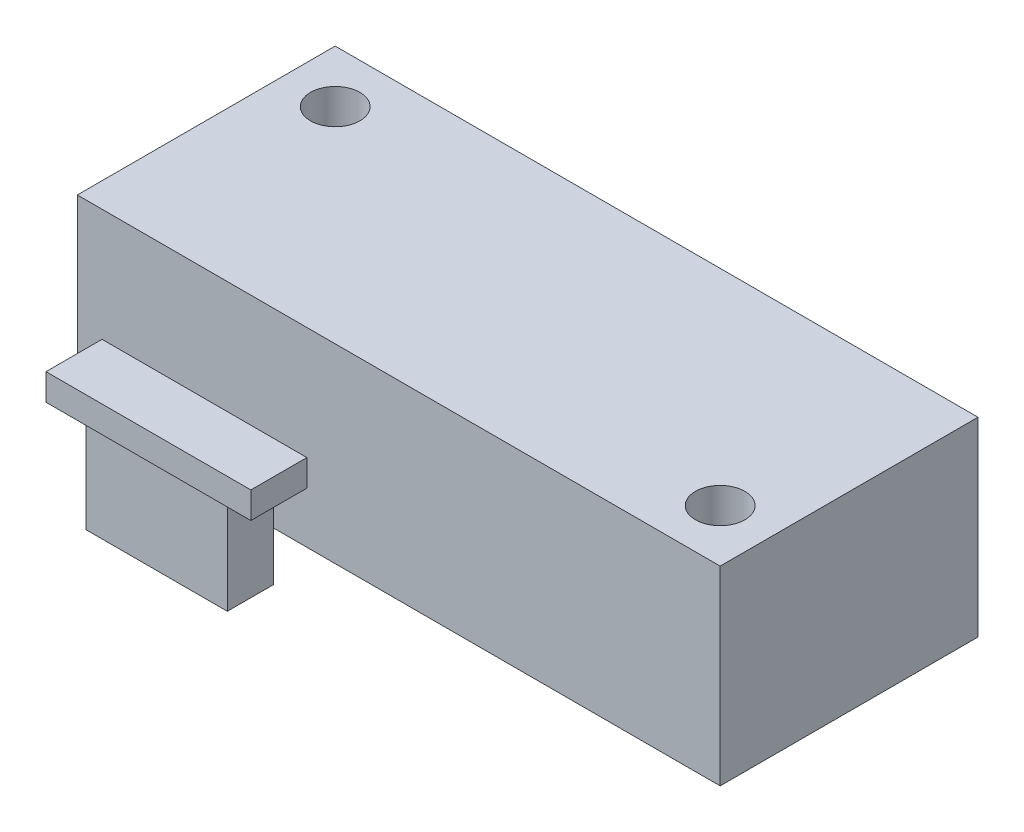
from build123d import *

# Parameters (mm, degrees)
SKETCH1_W           = 27.1018
SKETCH1_H           = 10.8712
SKETCH1_R           = 1.0414
BOSS_EXTRUDE4_DEPTH = 8.0264
SKETCH5_W           = 8.636
SKETCH5_H           = 2.3622
BOSS_EXTRUDE6_DEPTH = 1.1176
SKETCH6_W           = 5.969
SKETCH6_H           = 1.9558
BOSS_EXTRUDE7_DEPTH = 4.1656
SKETCH7_W           = 0.227948718
SKETCH7_H           = 2.54
CUT_EXTRUDE1_DEPTH  = 2.286


with BuildPart() as part:
    # Sketch1 → Boss-Extrude4 (new body)
    with BuildSketch(Plane(origin=(0, 0, 0), x_dir=(1, 0, 0), z_dir=(0, 1, 0))):
        with Locations((13.5509, 5.4356)):
            Rectangle(SKETCH1_W, SKETCH1_H)
        with Locations(Location((2.2098, 8.6614, 0), (0, 0, 270))):
            Circle(SKETCH1_R, mode=Mode.SUBTRACT)
        with Locations(Location((24.892, 2.2098, 0), (0, 0, 270))):
            Circle(SKETCH1_R, mode=Mode.SUBTRACT)
    extrude(amount=BOSS_EXTRUDE4_DEPTH)

    # Sketch5 → Boss-Extrude6 (add)
    with BuildSketch(Plane.XZ.offset(-2.159)):
        with Locations((5.3594, 1.1811)):
            Rectangle(SKETCH5_W, SKETCH5_H)
    extrude(amount=-BOSS_EXTRUDE6_DEPTH)

    # Sketch6 → Boss-Extrude7 (add)
    with BuildSketch(Plane.XZ.offset(-2.159)):
        with Locations((5.3467, 1.0287)):
            Rectangle(SKETCH6_W, SKETCH6_H)
    extrude(amount=BOSS_EXTRUDE7_DEPTH)

    # Sketch7 → Cut-Extrude1 (cut)
    # profile 1 of 12: a face of its own
    with BuildSketch(Plane.XZ):
        Polygon((5.244862276, -1.594756442), (5.244862276, -1.334243621), (6.579990481, -1.334243621), (6.579990481, -1.594756442), (6.026400737, -1.594756442), (6.026400737, -3.874243621), (5.798452019, -3.874243621), (5.798452019, -1.594756442), align=None)
    # profile 2 of 12: a face of its own
    with BuildSketch(Plane.XZ):
        Polygon((6.970759711, -1.334243621), (7.198708429, -1.334243621), (7.198708429, -2.376294903), (8.501272532, -2.376294903), (8.501272532, -1.334243621), (8.72922125, -1.334243621), (8.72922125, -3.874243621), (8.501272532, -3.874243621), (8.501272532, -2.636807724), (7.198708429, -2.636807724), (7.198708429, -3.874243621), (6.970759711, -3.874243621), align=None)
    # profile 3 of 12: a face of its own
    with BuildSketch(Plane.XZ):
        with Locations((9.49447766, -2.604243621)):
            Rectangle(SKETCH7_W, SKETCH7_H)
    # profile 4 of 12: a face of its own
    with BuildSketch(Plane.XZ):
        with BuildLine():
            Line((9.99922125, -3.38425564), (10.213940801, -3.255525672))
            add(Edge.make_bspline(
                [(10.213940801, -3.255525672), (10.233911179, -3.288955255), (10.272173652, -3.353005044), (10.33600121, -3.439552308), (10.402137666, -3.513112273), (10.471072782, -3.573257011), (10.542385784, -3.62060906), (10.616542212, -3.65413868), (10.693292166, -3.675050845), (10.745524597, -3.677590908), (10.771601058, -3.678859006)],
                knots=[0, 0, 0, 0, 1.272034388, 2.437168799, 3.508375237, 4.49857839, 5.41946034, 6.295179144, 7.148887113, 8, 8, 8, 8], degree=3))
            add(Edge.make_bspline(
                [(10.771601058, -3.678859006), (10.793870951, -3.678238758), (10.838021066, -3.677009114), (10.903017665, -3.665193904), (10.966141602, -3.647042245), (11.02609187, -3.621046483), (11.082041259, -3.589595125), (11.131104404, -3.551606756), (11.173519583, -3.509075395), (11.20821534, -3.461626269), (11.234834566, -3.410596109), (11.255293953, -3.35821699), (11.266647806, -3.303666087), (11.268358136, -3.266937351), (11.26922125, -3.248402275)],
                knots=[0, 0, 0, 0, 1.095163259, 2.171163733, 3.241058638, 4.321873601, 5.38011039, 6.391990106, 7.366004449, 8.327778327, 9.272591725, 10.192022065, 11.087607919, 12, 12, 12, 12], degree=3))
            add(Edge.make_bspline(
                [(11.26922125, -3.248402275), (11.268151322, -3.227254344), (11.265976314, -3.184263691), (11.247592897, -3.120836514), (11.218673729, -3.05806762), (11.191994553, -3.019240988), (11.178143526, -2.999083365)],
                knots=[0, 0, 0, 0, 0.938893495, 1.908633276, 2.914225137, 4, 4, 4, 4], degree=3))
            add(Edge.make_bspline(
                [(11.178143526, -2.999083365), (11.166771137, -2.984535098), (11.14289623, -2.953992833), (11.101851635, -2.908530291), (11.053688798, -2.861635781), (11.000055932, -2.811518637), (10.938999348, -2.760509779), (10.87243138, -2.7061768), (10.798652465, -2.650585941), (10.746909402, -2.613304136), (10.720210833, -2.594067339)],
                knots=[0, 0, 0, 0, 0.722233717, 1.516239348, 2.393582979, 3.351407094, 4.387010283, 5.505090956, 6.712668013, 8, 8, 8, 8], degree=3))
            add(Edge.make_bspline(
                [(10.720210833, -2.594067339), (10.693487133, -2.575032878), (10.642393454, -2.538640439), (10.570940654, -2.484629673), (10.507045529, -2.435249265), (10.450992072, -2.390034353), (10.402804936, -2.348978806), (10.362104403, -2.312476873), (10.329927279, -2.279541374), (10.312034372, -2.258175372), (10.304000897, -2.248582563)],
                knots=[0, 0, 0, 0, 1.452282411, 2.77665338, 3.964542531, 5.026858415, 5.96415736, 6.766646006, 7.446254459, 8, 8, 8, 8], degree=3))
            add(Edge.make_bspline(
                [(10.304000897, -2.248582563), (10.29277225, -2.233632097), (10.270689609, -2.204229997), (10.241540565, -2.158274243), (10.216765287, -2.111231074), (10.19734348, -2.062974075), (10.180988624, -2.014180726), (10.169988297, -1.964214394), (10.163100255, -1.913299282), (10.16239487, -1.87903577), (10.162041763, -1.861883845)],
                knots=[0, 0, 0, 0, 1.068054152, 2.10047183, 3.106115577, 4.101338837, 5.06977816, 6.043150881, 7.020423561, 8, 8, 8, 8], degree=3))
            add(Edge.make_bspline(
                [(10.162041763, -1.861883845), (10.162988972, -1.835010809), (10.164863143, -1.781839129), (10.180713119, -1.704165326), (10.20573059, -1.630007183), (10.24077888, -1.560098884), (10.285959931, -1.496260715), (10.338244723, -1.437758356), (10.400519345, -1.388577727), (10.468847249, -1.345606691), (10.54363673, -1.311972791), (10.622007271, -1.286601108), (10.704083432, -1.272225247), (10.759675421, -1.270162212), (10.787883109, -1.269115416)],
                knots=[0, 0, 0, 0, 1.005424448, 1.989358655, 2.955360095, 3.929531133, 4.905563448, 5.876582895, 6.856512386, 7.866279853, 8.892233794, 9.918561126, 10.94386622, 12, 12, 12, 12], degree=3))
            add(Edge.make_bspline(
                [(10.787883109, -1.269115416), (10.817814542, -1.270147782), (10.877338608, -1.272200829), (10.964895468, -1.290051608), (11.049194959, -1.319588667), (11.117008071, -1.353108436), (11.170081561, -1.386586664), (11.21055663, -1.41708105), (11.251572151, -1.452187558), (11.293458968, -1.491999696), (11.335507332, -1.536882767), (11.378341495, -1.586529381), (11.422061621, -1.640636139), (11.450187303, -1.67926192), (11.464605865, -1.699063333)],
                knots=[0, 0, 0, 0, 1.286793592, 2.559021753, 3.825965368, 5.121522368, 5.803751409, 6.523245864, 7.299691795, 8.125521123, 9.008227632, 9.944561021, 10.946284179, 12, 12, 12, 12], degree=3))
            Line((11.464605865, -1.699063333), (11.258536154, -1.855269262))
            add(Edge.make_bspline(
                [(11.258536154, -1.855269262), (11.246093106, -1.839239184), (11.222130704, -1.808369001), (11.185751019, -1.765137247), (11.151462001, -1.72564643), (11.117679711, -1.691345451), (11.086188332, -1.660355903), (11.055623393, -1.633823965), (11.02642475, -1.611489676), (10.989618763, -1.587654635), (10.943377905, -1.564027916), (10.885331984, -1.544035156), (10.82467223, -1.532020911), (10.783357583, -1.530432404), (10.762442404, -1.529628237)],
                knots=[0, 0, 0, 0, 1.181633172, 2.275549214, 3.290209073, 4.226197932, 5.078386478, 5.862611352, 6.581680152, 7.217281963, 8.414376989, 9.595101626, 10.782541182, 12, 12, 12, 12], degree=3))
            add(Edge.make_bspline(
                [(10.762442404, -1.529628237), (10.736203099, -1.530507584), (10.685603071, -1.532203324), (10.613764443, -1.550723542), (10.549107709, -1.579884092), (10.493552419, -1.620752676), (10.447297584, -1.669173054), (10.413838194, -1.724892566), (10.393699503, -1.786420367), (10.391242031, -1.829340311), (10.389990481, -1.851198749)],
                knots=[0, 0, 0, 0, 1.14458467, 2.207223713, 3.21896685, 4.227309161, 5.202851033, 6.127160689, 7.046193047, 8, 8, 8, 8], degree=3))
            add(Edge.make_bspline(
                [(10.389990481, -1.851198749), (10.390275778, -1.864806965), (10.39084684, -1.892045649), (10.398811408, -1.932287538), (10.409043492, -1.972427767), (10.425257859, -2.01228587), (10.447642737, -2.052558919), (10.477037921, -2.093940409), (10.514059011, -2.136795077), (10.542417757, -2.164667857), (10.55739032, -2.179383845)],
                knots=[0, 0, 0, 0, 0.858281714, 1.717966888, 2.583508476, 3.4729293, 4.427298488, 5.488583878, 6.674047936, 8, 8, 8, 8], degree=3))
            add(Edge.make_bspline(
                [(10.55739032, -2.179383845), (10.562950288, -2.184345573), (10.576159498, -2.196133501), (10.600308312, -2.215431899), (10.632198229, -2.23923734), (10.670996512, -2.268692135), (10.71741854, -2.302859825), (10.771469418, -2.341303532), (10.832546645, -2.385271265), (10.875887692, -2.416010737), (10.898804583, -2.432264454)],
                knots=[0, 0, 0, 0, 0.420754252, 0.999615792, 1.744751191, 2.668019286, 3.750313428, 4.999500688, 6.413464383, 8, 8, 8, 8], degree=3))
            add(Edge.make_bspline(
                [(10.898804583, -2.432264454), (10.926371503, -2.452324184), (10.979751023, -2.49116707), (11.055702524, -2.549525878), (11.124568316, -2.606601687), (11.186590184, -2.662030007), (11.242380854, -2.715390395), (11.291321372, -2.767324817), (11.333910408, -2.817461204), (11.37976047, -2.881739588), (11.426611002, -2.960683575), (11.466845696, -3.057405496), (11.492215468, -3.154503398), (11.495533082, -3.219764587), (11.497169968, -3.251963974)],
                knots=[0, 0, 0, 0, 1.163667725, 2.253281268, 3.268753668, 4.215851969, 5.092017293, 5.902905408, 6.650798638, 7.335211899, 8.59617414, 9.77448103, 10.901945474, 12, 12, 12, 12], degree=3))
            add(Edge.make_bspline(
                [(11.497169968, -3.251963974), (11.496693073, -3.274735702), (11.495748545, -3.319836946), (11.484891196, -3.386062058), (11.468983782, -3.450382747), (11.44500819, -3.512003954), (11.415745098, -3.57205301), (11.378613021, -3.628954744), (11.335572587, -3.68396853), (11.286199511, -3.735627407), (11.232173057, -3.783050075), (11.175071175, -3.825235165), (11.114800406, -3.86040932), (11.051687707, -3.889111931), (10.985718583, -3.911560827), (10.91691522, -3.927826166), (10.845164203, -3.937808882), (10.796395854, -3.938845029), (10.771601058, -3.939371826)],
                knots=[0, 0, 0, 0, 0.983748083, 1.948392443, 2.894712957, 3.844097841, 4.80183111, 5.778335162, 6.776009319, 7.81870978, 8.863265674, 9.881300176, 10.883814829, 11.87499822, 12.874611388, 13.892143829, 14.928324115, 16, 16, 16, 16], degree=3))
            add(Edge.make_bspline(
                [(10.771601058, -3.939371826), (10.752416552, -3.939000854), (10.714289149, -3.938263583), (10.657894267, -3.931745739), (10.60263868, -3.922524013), (10.549215744, -3.907883402), (10.496937165, -3.89012011), (10.446030315, -3.868248292), (10.396470521, -3.842037523), (10.347980047, -3.812069133), (10.300682217, -3.777192941), (10.255020661, -3.736572175), (10.209497195, -3.691327152), (10.165455484, -3.6402292), (10.122004688, -3.584103849), (10.080001499, -3.522425984), (10.038576481, -3.455531562), (10.012584685, -3.408458042), (9.99922125, -3.38425564)],
                knots=[0, 0, 0, 0, 0.915332311, 1.819136955, 2.706846663, 3.586547465, 4.459518054, 5.340707479, 6.227863349, 7.133153174, 8.059268498, 9.028702269, 10.047606654, 11.120612155, 12.245963614, 13.433783089, 14.680604001, 16, 16, 16, 16], degree=3))
        make_face()
    # profile 5 of 12: a face of its own
    with BuildSketch(Plane.XZ):
        with BuildLine():
            Line((12.995118686, -1.334243621), (13.493247692, -1.334243621))
            add(Edge.make_bspline(
                [(13.493247692, -1.334243621), (13.527509321, -1.334281283), (13.593156124, -1.334353445), (13.687292193, -1.336541289), (13.772788398, -1.339463517), (13.849460389, -1.343514376), (13.917544072, -1.348301616), (13.976731369, -1.355015953), (14.027487504, -1.362026568), (14.057899613, -1.369154103), (14.071769327, -1.372404679)],
                knots=[0, 0, 0, 0, 1.415646017, 2.712440637, 3.8905458, 4.950247383, 5.884950622, 6.709939814, 7.411656543, 8, 8, 8, 8], degree=3))
            add(Edge.make_bspline(
                [(14.071769327, -1.372404679), (14.08932692, -1.377210322), (14.124028383, -1.386708371), (14.174030855, -1.405732044), (14.221604217, -1.428288816), (14.266911691, -1.453996475), (14.309396517, -1.483957998), (14.349692558, -1.516958852), (14.387444201, -1.553760962), (14.422439154, -1.593951556), (14.454577264, -1.636855937), (14.482248519, -1.683114584), (14.505418564, -1.731948844), (14.525290995, -1.78332475), (14.539593702, -1.837673728), (14.55036831, -1.894618142), (14.557207171, -1.954151888), (14.557862173, -1.994835335), (14.558195609, -2.015545704)],
                knots=[0, 0, 0, 0, 0.999701418, 1.975846123, 2.934577507, 3.890451536, 4.834027766, 5.787354733, 6.749476667, 7.726910423, 8.712836071, 9.690891519, 10.682875813, 11.679750201, 12.712814741, 13.765529915, 14.8625177, 16, 16, 16, 16], degree=3))
            add(Edge.make_bspline(
                [(14.558195609, -2.015545704), (14.557889775, -2.036430148), (14.55729139, -2.077291973), (14.550109515, -2.137071082), (14.540435604, -2.194198142), (14.5255606, -2.248546486), (14.506078312, -2.29979336), (14.483224079, -2.348721911), (14.455658889, -2.39449973), (14.423985212, -2.43729301), (14.388750627, -2.477141917), (14.350104209, -2.513757683), (14.308201979, -2.546925974), (14.263177106, -2.576721149), (14.214590644, -2.602452278), (14.163179481, -2.625499007), (14.108496753, -2.644854577), (14.070656186, -2.655036393), (14.051416763, -2.660213172)],
                knots=[0, 0, 0, 0, 1.121902311, 2.195077645, 3.232258892, 4.234102512, 5.217864754, 6.176164875, 7.132989551, 8.084763148, 9.034132444, 9.988522005, 10.94243251, 11.903244335, 12.886203696, 13.894208494, 14.929344452, 16, 16, 16, 16], degree=3))
            add(Edge.make_bspline(
                [(14.051416763, -2.660213172), (14.035503783, -2.663597164), (14.000629563, -2.67101338), (13.943194559, -2.67929266), (13.876323336, -2.686359376), (13.800107167, -2.691657915), (13.714614465, -2.696193897), (13.619798981, -2.699799314), (13.515474594, -2.701780408), (13.442706319, -2.701882583), (13.404714038, -2.701935929)],
                knots=[0, 0, 0, 0, 0.601384939, 1.31797006, 2.144135048, 3.087295005, 4.142315834, 5.309527816, 6.595305764, 8, 8, 8, 8], degree=3))
            Line((13.404714038, -2.701935929), (13.223067404, -2.701935929))
            Line((13.223067404, -2.701935929), (13.223067404, -3.874243621))
            Line((13.223067404, -3.874243621), (12.995118686, -3.874243621))
            Line((12.995118686, -3.874243621), (12.995118686, -1.334243621))
        make_face()
        with BuildLine():
            Line((13.223067404, -1.594756442), (13.223067404, -2.441423108))
            Line((13.223067404, -2.441423108), (13.667770929, -2.447020063))
            add(Edge.make_bspline(
                [(13.667770929, -2.447020063), (13.689484247, -2.447031286), (13.731401359, -2.44705295), (13.791952218, -2.444160816), (13.848129244, -2.440822144), (13.899759878, -2.435933788), (13.946867397, -2.429024075), (13.989530346, -2.4220487), (14.027417917, -2.41195738), (14.071758481, -2.398369781), (14.121167539, -2.375195825), (14.174919417, -2.341559048), (14.220472928, -2.298683334), (14.259892492, -2.250475708), (14.291175043, -2.196846054), (14.314075678, -2.139464597), (14.32753126, -2.078919815), (14.329335527, -2.037490137), (14.330246891, -2.016563333)],
                knots=[0, 0, 0, 0, 1.160613943, 2.240541288, 3.23993089, 4.169200891, 5.011653406, 5.7853311, 6.478053781, 7.106038997, 8.262395093, 9.384106736, 10.481365981, 11.59014053, 12.70357646, 13.786202915, 14.881775077, 16, 16, 16, 16], degree=3))
            add(Edge.make_bspline(
                [(14.330246891, -2.016563333), (14.32933057, -1.996142811), (14.327509038, -1.955549343), (14.313970212, -1.896056185), (14.291219567, -1.839279417), (14.259682496, -1.786321806), (14.221407504, -1.738287646), (14.176921695, -1.696561159), (14.126329786, -1.663017409), (14.079268498, -1.64136697), (14.037466494, -1.628147885), (14.001157586, -1.618898772), (13.960161497, -1.611514189), (13.91446488, -1.605534664), (13.86442192, -1.600415867), (13.809602686, -1.596942615), (13.750214842, -1.594909558), (13.708986599, -1.594808716), (13.687614679, -1.594756442)],
                knots=[0, 0, 0, 0, 1.120700087, 2.227813068, 3.331159281, 4.466773991, 5.599788987, 6.693661531, 7.80175334, 8.91857717, 9.525282508, 10.207424825, 10.974604443, 11.810962634, 12.737642355, 13.736264703, 14.826523623, 16, 16, 16, 16], degree=3))
            Line((13.687614679, -1.594756442), (13.223067404, -1.594756442))
        make_face(mode=Mode.SUBTRACT)
    # profile 6 of 12: a face of its own
    with BuildSketch(Plane.XZ):
        Polygon((16.121272532, -1.334243621), (17.293580224, -3.874243621), (17.045787756, -3.874243621), (16.670282949, -3.060141057), (15.518836635, -3.060141057), (15.132646731, -3.874243621), (14.883836635, -3.874243621), (16.088708429, -1.334243621), align=None)
        Polygon((16.10244641, -1.829319743), (15.642478461, -2.799628237), (16.55020282, -2.799628237), align=None, mode=Mode.SUBTRACT)
    # profile 7 of 12: a face of its own
    with BuildSketch(Plane.XZ):
        with BuildLine():
            Line((17.74947766, -1.334243621), (18.257782949, -1.334243621))
            add(Edge.make_bspline(
                [(18.257782949, -1.334243621), (18.291703653, -1.334356532), (18.356835164, -1.334573334), (18.450142623, -1.335782202), (18.534925716, -1.33924702), (18.611140114, -1.342228677), (18.678784418, -1.347665686), (18.738066052, -1.35286227), (18.788711981, -1.35966487), (18.819370398, -1.36598252), (18.833251699, -1.36884298)],
                knots=[0, 0, 0, 0, 1.410062039, 2.707475311, 3.878576406, 4.937260626, 5.877586885, 6.699081471, 7.410979367, 8, 8, 8, 8], degree=3))
            add(Edge.make_bspline(
                [(18.833251699, -1.36884298), (18.851834792, -1.373434404), (18.88860455, -1.382519305), (18.941545455, -1.401721415), (18.991992993, -1.423942514), (19.039737608, -1.4500419), (19.084540154, -1.480213311), (19.126862585, -1.513935891), (19.16689695, -1.551025121), (19.20302419, -1.59241612), (19.23708853, -1.63584033), (19.265818562, -1.68279677), (19.290584636, -1.731899708), (19.310302668, -1.783648519), (19.326179826, -1.837541348), (19.337374869, -1.894066361), (19.344088588, -1.95296604), (19.344772106, -1.993140065), (19.345118686, -2.013510448)],
                knots=[0, 0, 0, 0, 1.027469482, 2.033020251, 3.019912614, 3.986113645, 4.951240523, 5.91722682, 6.890402269, 7.87763091, 8.8651537, 9.85103654, 10.82876324, 11.815024772, 12.821070561, 13.842952187, 14.906261191, 16, 16, 16, 16], degree=3))
            add(Edge.make_bspline(
                [(19.345118686, -2.013510448), (19.344052613, -2.04735421), (19.341972429, -2.113392154), (19.322577639, -2.209230623), (19.290808393, -2.298630868), (19.247030921, -2.381480325), (19.19128193, -2.456164051), (19.12428051, -2.521761696), (19.045989283, -2.576654661), (18.973106294, -2.61472041), (18.908725132, -2.639099264), (18.855723814, -2.656252507), (18.79790835, -2.669505476), (18.735832684, -2.681378258), (18.669238488, -2.690342059), (18.598285374, -2.696907302), (18.522922738, -2.701010526), (18.471150957, -2.701621581), (18.444517724, -2.701935929)],
                knots=[0, 0, 0, 0, 1.260483769, 2.459530307, 3.627416485, 4.787058657, 5.939039949, 7.08810263, 8.267026773, 9.491475466, 10.141966685, 10.831826277, 11.566392101, 12.351337768, 13.187381173, 14.07005841, 15.007169909, 16, 16, 16, 16], degree=3))
            Line((18.444517724, -2.701935929), (19.377682788, -3.874243621))
            Line((19.377682788, -3.874243621), (19.095799776, -3.874243621))
            Line((19.095799776, -3.874243621), (18.162634711, -2.701935929))
            Line((18.162634711, -2.701935929), (17.977426378, -2.701935929))
            Line((17.977426378, -2.701935929), (17.977426378, -3.874243621))
            Line((17.977426378, -3.874243621), (17.74947766, -3.874243621))
            Line((17.74947766, -3.874243621), (17.74947766, -1.334243621))
        make_face()
        with BuildLine():
            Line((17.977426378, -1.594756442), (17.977426378, -2.441423108))
            Line((17.977426378, -2.441423108), (18.442482468, -2.444984807))
            add(Edge.make_bspline(
                [(18.442482468, -2.444984807), (18.464195868, -2.444994413), (18.50628262, -2.445013032), (18.567170531, -2.442114692), (18.623863413, -2.438817541), (18.676144416, -2.433774302), (18.724036896, -2.427274752), (18.767516916, -2.419144587), (18.806655451, -2.409672518), (18.852301818, -2.39501191), (18.903273473, -2.371784685), (18.958668304, -2.337991438), (19.005841429, -2.295486991), (19.045696106, -2.246883397), (19.077721465, -2.19344452), (19.100299927, -2.135810926), (19.114627299, -2.075437595), (19.116317158, -2.033942625), (19.117169968, -2.013001634)],
                knots=[0, 0, 0, 0, 1.146690395, 2.22261258, 3.21895312, 4.145990853, 4.996080663, 5.770904154, 6.481378293, 7.121626537, 8.300444488, 9.431385265, 10.535395872, 11.636531494, 12.74115979, 13.810798291, 14.895190096, 16, 16, 16, 16], degree=3))
            add(Edge.make_bspline(
                [(19.117169968, -2.013001634), (19.116297571, -1.992575263), (19.1145688, -1.95209765), (19.100454551, -1.892838789), (19.076586257, -1.836910203), (19.044420976, -1.784539405), (19.005233018, -1.737000957), (18.959282376, -1.696326737), (18.907825463, -1.66276284), (18.859731508, -1.641314804), (18.816744394, -1.628164967), (18.779421155, -1.618911266), (18.737248825, -1.611476708), (18.690022635, -1.605520001), (18.637944195, -1.600400127), (18.580750179, -1.596951694), (18.518820059, -1.594909632), (18.475896286, -1.594808694), (18.453676378, -1.594756442)],
                knots=[0, 0, 0, 0, 1.101028733, 2.181837193, 3.264309656, 4.369019818, 5.486613113, 6.575447106, 7.666700264, 8.788928104, 9.402425223, 10.0903467, 10.862060571, 11.710948788, 12.657782767, 13.684531032, 14.801375019, 16, 16, 16, 16], degree=3))
            Line((18.453676378, -1.594756442), (17.977426378, -1.594756442))
        make_face(mode=Mode.SUBTRACT)
    # profile 8 of 12: a face of its own
    with BuildSketch(Plane.XZ):
        Polygon((19.605631506, -1.594756442), (19.605631506, -1.334243621), (20.940759711, -1.334243621), (20.940759711, -1.594756442), (20.387169968, -1.594756442), (20.387169968, -3.874243621), (20.15922125, -3.874243621), (20.15922125, -1.594756442), align=None)
    # profile 9 of 12: a face of its own
    with BuildSketch(Plane.XZ):
        with BuildLine():
            Line((5.537939199, -9.107576954), (5.537939199, -6.567576954))
            Line((5.537939199, -6.567576954), (6.050823814, -6.567576954))
            add(Edge.make_bspline(
                [(6.050823814, -6.567576954), (6.095432737, -6.567898134), (6.181616944, -6.568518651), (6.306158548, -6.572453032), (6.421390193, -6.57941297), (6.526932897, -6.589550854), (6.623076405, -6.601999056), (6.709551509, -6.617602207), (6.78680535, -6.636026765), (6.834317458, -6.651735177), (6.856785353, -6.659163493)],
                knots=[0, 0, 0, 0, 1.314313732, 2.53924729, 3.670748893, 4.714932338, 5.66265055, 6.526160246, 7.303039223, 8, 8, 8, 8], degree=3))
            add(Edge.make_bspline(
                [(6.856785353, -6.659163493), (6.886172963, -6.670361776), (6.944281771, -6.692504404), (7.027018369, -6.734273834), (7.104905918, -6.781599913), (7.178362097, -6.834545025), (7.245708983, -6.894608295), (7.309577571, -6.959238294), (7.367355113, -7.030785261), (7.420265705, -7.107765395), (7.467971012, -7.189271856), (7.509437716, -7.275149335), (7.543875756, -7.364961709), (7.572463984, -7.458459216), (7.594994841, -7.555847445), (7.610366872, -7.657239793), (7.620505819, -7.762235548), (7.621524759, -7.833482159), (7.622041763, -7.869632243)],
                knots=[0, 0, 0, 0, 0.984719456, 1.947108742, 2.898477687, 3.838006223, 4.779231079, 5.722358779, 6.681677486, 7.655904652, 8.64651281, 9.637519902, 10.640069247, 11.656948941, 12.698408672, 13.768548281, 14.867775369, 16, 16, 16, 16], degree=3))
            add(Edge.make_bspline(
                [(7.622041763, -7.869632243), (7.621585312, -7.901027542), (7.620685828, -7.962895257), (7.612609125, -8.05407465), (7.600869738, -8.14254907), (7.582694806, -8.227897207), (7.560631268, -8.310866828), (7.532354427, -8.390573657), (7.499961809, -8.467748878), (7.462188469, -8.541348989), (7.42072015, -8.611078065), (7.376218084, -8.67681002), (7.32872974, -8.737606895), (7.27780228, -8.793652802), (7.224093823, -8.844863251), (7.167252738, -8.891666027), (7.107132352, -8.933145356), (7.044001942, -8.9709312), (6.976019837, -9.003893401), (6.90189838, -9.031782608), (6.821321468, -9.054894152), (6.734486882, -9.07417703), (6.641244587, -9.08947313), (6.541503166, -9.099724855), (6.435415864, -9.106657555), (6.362569197, -9.107264537), (6.325074615, -9.107576954)],
                knots=[0, 0, 0, 0, 1.105936401, 2.179363191, 3.223086493, 4.248585256, 5.251745608, 6.245858792, 7.225916811, 8.198733463, 9.158002045, 10.082870192, 10.993790845, 11.873723703, 12.748670949, 13.606408763, 14.465103618, 15.319838547, 16.196477973, 17.123216899, 18.106603292, 19.147568657, 20.255746949, 21.433717677, 22.679120308, 24, 24, 24, 24], degree=3))
            Line((6.325074615, -9.107576954), (5.537939199, -9.107576954))
        make_face()
        with BuildLine():
            Line((5.765887917, -8.847064134), (6.057438397, -8.847064134))
            add(Edge.make_bspline(
                [(6.057438397, -8.847064134), (6.099332701, -8.846884087), (6.179910789, -8.84653779), (6.295776878, -8.843499077), (6.40164364, -8.838533785), (6.497526107, -8.831585015), (6.583370142, -8.82239122), (6.659355149, -8.812140576), (6.725232051, -8.799369855), (6.765095128, -8.787794015), (6.783516122, -8.782444743)],
                knots=[0, 0, 0, 0, 1.375205317, 2.645023457, 3.804390687, 4.853969522, 5.800190428, 6.637939096, 7.370582563, 8, 8, 8, 8], degree=3))
            add(Edge.make_bspline(
                [(6.783516122, -8.782444743), (6.806701504, -8.774279326), (6.852518488, -8.758143524), (6.918472189, -8.72871025), (6.979981559, -8.693845434), (7.038118548, -8.65509064), (7.092058464, -8.61107897), (7.142440537, -8.562767453), (7.18916333, -8.509910216), (7.231744113, -8.452572865), (7.26985014, -8.39111227), (7.302849261, -8.326132659), (7.331770086, -8.258346003), (7.354469408, -8.186711356), (7.372260718, -8.111869125), (7.38486252, -8.033814045), (7.39271092, -7.952560692), (7.39362637, -7.897296007), (7.394093045, -7.869123429)],
                knots=[0, 0, 0, 0, 0.998632004, 1.973411704, 2.929992603, 3.868527914, 4.809262121, 5.754881198, 6.702106254, 7.672490631, 8.653608572, 9.636854334, 10.631411391, 11.644891563, 12.686317036, 13.754757253, 14.855430412, 16, 16, 16, 16], degree=3))
            add(Edge.make_bspline(
                [(7.394093045, -7.869123429), (7.393720545, -7.839417417), (7.392988765, -7.781059695), (7.383790837, -7.695432162), (7.37034948, -7.613077633), (7.350912176, -7.533990599), (7.32614291, -7.458016767), (7.29523137, -7.385576322), (7.259913309, -7.315904217), (7.21789203, -7.250608535), (7.171870428, -7.18885525), (7.120796196, -7.132282254), (7.065480774, -7.080760676), (7.006527483, -7.033488146), (6.942274845, -6.992366507), (6.874236452, -6.955582459), (6.801414165, -6.924365212), (6.750750095, -6.907761694), (6.7250025, -6.899323749)],
                knots=[0, 0, 0, 0, 1.122418816, 2.205001699, 3.251619955, 4.274784885, 5.280384055, 6.268708349, 7.249350384, 8.229342522, 9.199999885, 10.157847722, 11.105861043, 12.055065948, 13.010012805, 13.98527497, 14.976112212, 16, 16, 16, 16], degree=3))
            add(Edge.make_bspline(
                [(6.7250025, -6.899323749), (6.703701954, -6.893433542), (6.658411148, -6.880909344), (6.584504794, -6.867247502), (6.501326943, -6.85519738), (6.408508303, -6.84499526), (6.306154678, -6.837674747), (6.19418735, -6.832180136), (6.072557923, -6.82847418), (5.988242598, -6.828221118), (5.944481667, -6.828089775)],
                knots=[0, 0, 0, 0, 0.674548936, 1.434276114, 2.292660221, 3.240891867, 4.284742987, 5.42552168, 6.663806718, 8, 8, 8, 8], degree=3))
            Line((5.944481667, -6.828089775), (5.765887917, -6.828089775))
            Line((5.765887917, -6.828089775), (5.765887917, -8.847064134))
        make_face(mode=Mode.SUBTRACT)
    # profile 10 of 12: a face of its own
    with BuildSketch(Plane.XZ):
        with BuildLine():
            add(Edge.make_bspline(
                [(9.331657147, -6.502448749), (9.378689316, -6.503639994), (9.471064375, -6.505979698), (9.6068273, -6.523889676), (9.736436312, -6.55487433), (9.860947213, -6.596140609), (9.978870687, -6.65118922), (10.091094341, -6.717726442), (10.197351158, -6.796449358), (10.29620896, -6.886749425), (10.38667429, -6.984999132), (10.466376505, -7.089848815), (10.533172912, -7.200664517), (10.588026598, -7.317113235), (10.631060446, -7.438931611), (10.66075598, -7.566769088), (10.679724809, -7.699797371), (10.681942431, -7.790531153), (10.683067404, -7.836559326)],
                knots=[0, 0, 0, 0, 1.065120563, 2.091984664, 3.0946048, 4.079830382, 5.057816894, 6.036188127, 7.030412546, 8.04752943, 9.064399622, 10.05169764, 11.02544977, 11.989514704, 12.962713494, 13.945757189, 14.957906945, 16, 16, 16, 16], degree=3))
            add(Edge.make_bspline(
                [(10.683067404, -7.836559326), (10.681942596, -7.882248444), (10.679725468, -7.97230699), (10.660734413, -8.104491089), (10.630950373, -8.231556909), (10.588426225, -8.353292325), (10.533834021, -8.469825757), (10.46659284, -8.580850575), (10.387387504, -8.686403177), (10.297248818, -8.785327225), (10.198986347, -8.876039676), (10.093590668, -8.95508366), (9.983432087, -9.023100596), (9.867093042, -9.077372176), (9.746116443, -9.120749513), (9.619419558, -9.150324279), (9.487596058, -9.169401162), (9.397701101, -9.171591742), (9.352009711, -9.17270516)],
                knots=[0, 0, 0, 0, 1.043624062, 2.057103931, 3.04512605, 4.022047818, 4.998200453, 5.980619268, 6.982898556, 8.009068085, 9.034988726, 10.034168286, 11.015286542, 11.987931943, 12.962482838, 13.94673481, 14.956375938, 16, 16, 16, 16], degree=3))
            add(Edge.make_bspline(
                [(9.352009711, -9.17270516), (9.305981777, -9.171580747), (9.215248466, -9.169364232), (9.082053018, -9.150364012), (8.954125741, -9.120652323), (8.831832469, -9.078191189), (8.715105005, -9.023314685), (8.60371506, -8.95640065), (8.498109736, -8.877002324), (8.399164583, -8.786892867), (8.308632307, -8.688796941), (8.229704075, -8.583688653), (8.162774992, -8.473630122), (8.108082745, -8.358315919), (8.064783395, -8.2383035), (8.035243327, -8.112792319), (8.01613095, -7.982497935), (8.013928519, -7.893784518), (8.012810994, -7.848770865)],
                knots=[0, 0, 0, 0, 1.053102029, 2.075944431, 3.073151272, 4.055350789, 5.033113405, 6.020478099, 7.024410459, 8.052272461, 9.079885166, 10.07527673, 11.055994387, 12.023226415, 12.992069828, 13.970394897, 14.97016774, 16, 16, 16, 16], degree=3))
            add(Edge.make_bspline(
                [(8.012810994, -7.848770865), (8.013198986, -7.818557442), (8.013970077, -7.758511752), (8.023253191, -7.669345705), (8.036723682, -7.581613628), (8.05602907, -7.495564997), (8.08127788, -7.411410454), (8.111069923, -7.328569615), (8.147457125, -7.247881998), (8.188591081, -7.168965365), (8.234501079, -7.093049914), (8.285210908, -7.021291587), (8.338939433, -6.953088236), (8.397840867, -6.890207267), (8.459973944, -6.830819414), (8.526346596, -6.775837327), (8.596553825, -6.72476522), (8.670897723, -6.678740173), (8.747546414, -6.637113829), (8.826559847, -6.601392829), (8.906864902, -6.570734258), (8.988837704, -6.545885202), (9.072260572, -6.526267668), (9.157315582, -6.512909188), (9.243934971, -6.503602398), (9.302290614, -6.502834953), (9.331657147, -6.502448749)],
                knots=[0, 0, 0, 0, 1.037015668, 2.060948919, 3.074880161, 4.083647147, 5.086022904, 6.090072063, 7.104153813, 8.122640571, 9.144368836, 10.147691507, 11.138137339, 12.123020368, 13.103399296, 14.087645067, 15.080126199, 16.082011238, 17.087798457, 18.072939717, 19.057185487, 20.037253025, 21.01195951, 21.997135196, 22.992090687, 24, 24, 24, 24], degree=3))
        make_face()
        with BuildLine():
            add(Edge.make_bspline(
                [(9.342851058, -6.76296157), (9.318746724, -6.763255404), (9.270768495, -6.763840265), (9.199442003, -6.771544241), (9.129053571, -6.782524218), (9.059588662, -6.798186236), (8.991337926, -6.819525177), (8.923665184, -6.844084007), (8.85718754, -6.873998742), (8.792124454, -6.907797218), (8.729048942, -6.945207007), (8.669531153, -6.986552232), (8.613417006, -7.030863297), (8.560843893, -7.078243613), (8.511966185, -7.128934467), (8.465821859, -7.182167378), (8.424260505, -7.239463893), (8.386170972, -7.299270303), (8.352085739, -7.361508707), (8.321776025, -7.425523865), (8.296982716, -7.491837957), (8.276762591, -7.559731546), (8.259998728, -7.629097102), (8.249378681, -7.700460833), (8.241590054, -7.773464143), (8.241038623, -7.822799545), (8.240759711, -7.847753237)],
                knots=[0, 0, 0, 0, 1.008559885, 2.007477868, 2.99961109, 3.989939068, 4.984837346, 5.991145699, 7.001802488, 8.033829008, 9.059044045, 10.069351652, 11.065060232, 12.050310815, 13.029377138, 14.011219647, 14.996725999, 15.989392538, 16.977580475, 17.965360261, 18.951710183, 19.937753436, 20.929683414, 21.935841486, 22.955955122, 24, 24, 24, 24], degree=3))
            add(Edge.make_bspline(
                [(8.240759711, -7.847753237), (8.241684897, -7.884446962), (8.243505023, -7.956634873), (8.259439945, -8.062420897), (8.283985036, -8.164084968), (8.320167239, -8.261070811), (8.36541597, -8.35421209), (8.421315485, -8.442682543), (8.487543507, -8.526506081), (8.562773609, -8.605097505), (8.645013516, -8.676831317), (8.732340698, -8.739796762), (8.823819601, -8.793071629), (8.919688783, -8.836473024), (9.019436425, -8.870864434), (9.123705277, -8.894434641), (9.231800753, -8.909947114), (9.305483, -8.911436828), (9.342851058, -8.912192339)],
                knots=[0, 0, 0, 0, 1.032063989, 2.030389145, 3.003944642, 3.970395727, 4.937377036, 5.913328081, 6.909231446, 7.93887556, 8.970685674, 9.976071282, 10.964166581, 11.944589148, 12.933237628, 13.927779006, 14.949070134, 16, 16, 16, 16], degree=3))
            add(Edge.make_bspline(
                [(9.342851058, -8.912192339), (9.367967667, -8.911847259), (9.417781448, -8.911162861), (9.491873627, -8.904269535), (9.564630992, -8.89321555), (9.635951492, -8.87730016), (9.705754184, -8.85738133), (9.774330413, -8.833717436), (9.840949743, -8.804194506), (9.906452597, -8.771575135), (9.969151584, -8.734389421), (10.029005256, -8.694447449), (10.084504967, -8.65020165), (10.13703875, -8.603525295), (10.18611713, -8.553477245), (10.231408222, -8.50012257), (10.272759518, -8.443124493), (10.310834587, -8.383408799), (10.344800383, -8.321000089), (10.374394358, -8.256752837), (10.399501254, -8.190825244), (10.419769368, -8.123122218), (10.435651961, -8.053772345), (10.446595674, -7.982682768), (10.454250827, -7.909995702), (10.454827825, -7.860833018), (10.455118686, -7.836050512)],
                knots=[0, 0, 0, 0, 1.047197238, 2.076906641, 3.100256066, 4.114471768, 5.12198147, 6.126382909, 7.136867548, 8.15857795, 9.17633901, 10.174870724, 11.156907918, 12.133735059, 13.104061851, 14.077631395, 15.04955518, 16.038496417, 17.029181396, 18.010275684, 18.986308667, 19.968651475, 20.955262928, 21.950658345, 22.966943676, 24, 24, 24, 24], degree=3))
            add(Edge.make_bspline(
                [(10.455118686, -7.836050512), (10.454827592, -7.811437546), (10.454250155, -7.762613194), (10.446599331, -7.690433058), (10.435640399, -7.619855013), (10.419846891, -7.551156139), (10.399490493, -7.484318923), (10.374389974, -7.419406141), (10.344791499, -7.356175965), (10.310822102, -7.294784675), (10.272638047, -7.235875008), (10.230913653, -7.179557829), (10.184928515, -7.126890753), (10.135996486, -7.076573575), (10.082895329, -7.02967945), (10.025865584, -6.986192821), (9.965599601, -6.945064216), (9.90178955, -6.907961665), (9.835935366, -6.873697622), (9.768361237, -6.844341751), (9.69983269, -6.819397413), (9.630523992, -6.798121673), (9.559851773, -6.782585559), (9.488293566, -6.771534346), (9.415948372, -6.763842946), (9.36729415, -6.763256294), (9.342851058, -6.76296157)],
                knots=[0, 0, 0, 0, 1.02996197, 2.043119294, 3.035359645, 4.018872909, 4.991431989, 5.957985074, 6.929999688, 7.912076566, 8.892894881, 9.867085534, 10.843653904, 11.817741046, 12.803660682, 13.806313499, 14.818574707, 15.856120519, 16.894564902, 17.924820532, 18.937903209, 19.946497019, 20.957711757, 21.963978472, 22.977135795, 24, 24, 24, 24], degree=3))
        make_face(mode=Mode.SUBTRACT)
    # profile 11 of 12: a face of its own
    with BuildSketch(Plane.XZ):
        Polygon((11.041272532, -6.567576954), (11.276853461, -6.567576954), (11.77396484, -8.430345384), (12.513271731, -6.567576954), (12.546344647, -6.567576954), (13.271913558, -8.417625031), (13.771569006, -6.567576954), (14.004605865, -6.567576954), (13.319742083, -9.107576954), (13.287177981, -9.107576954), (12.522939199, -7.164924711), (11.749541763, -9.107576954), (11.71697766, -9.107576954), align=None)
    # profile 12 of 12: a face of its own
    with BuildSketch(Plane.XZ):
        Polygon((14.460503301, -9.107576954), (14.460503301, -6.567576954), (14.508331827, -6.567576954), (16.186400737, -8.566707563), (16.186400737, -6.567576954), (16.414349455, -6.567576954), (16.414349455, -9.107576954), (16.362450417, -9.107576954), (14.688452019, -7.113025672), (14.688452019, -9.107576954), align=None)
    extrude(amount=-CUT_EXTRUDE1_DEPTH, mode=Mode.SUBTRACT)


solid = part.part
